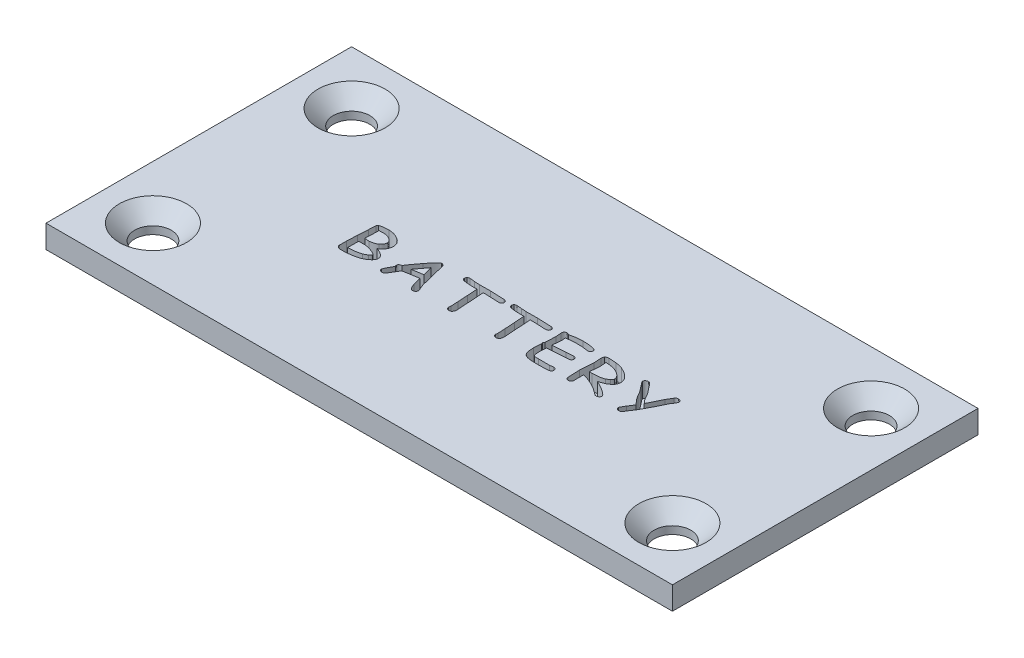
from build123d import *

# Parameters (mm, degrees)
SKETCH1_W                                       = 41
SKETCH1_H                                       = 20
BOSS_EXTRUDE2_DEPTH                             = 1.5
CSK_FOR_M2_FLAT_HEAD_MACHINE_SCREW1_D           = 2.4
CSK_FOR_M2_FLAT_HEAD_MACHINE_SCREW1_DEPTH       = 3.15
CSK_FOR_M2_FLAT_HEAD_MACHINE_SCREW1_CSINK_D     = 4.4
CSK_FOR_M2_FLAT_HEAD_MACHINE_SCREW1_CSINK_ANGLE = 90
CSK_FOR_M2_FLAT_HEAD_MACHINE_SCREW1_TIP         = 0.721032743
BATTERYTEXT_DEPTH                               = 1


with BuildPart() as part:
    # Sketch1 → Boss-Extrude2 (new body)
    with BuildSketch(Plane(origin=(0, 0, 0), x_dir=(1, 0, 0), z_dir=(0, 1, 0))):
        with Locations((20.5, 10)):
            Rectangle(SKETCH1_W, SKETCH1_H)
    extrude(amount=BOSS_EXTRUDE2_DEPTH)

    # CSK for M2 Flat Head Machine Screw1
    with Locations(Plane(origin=(3.5, 1.5, -3.5), x_dir=(0, 0, 1), z_dir=(0, 1, 0))):
        with Locations((0, 0), (-13, 0), (-13, 34), (0, 34)):
            CounterSinkHole(CSK_FOR_M2_FLAT_HEAD_MACHINE_SCREW1_D / 2, CSK_FOR_M2_FLAT_HEAD_MACHINE_SCREW1_CSINK_D / 2, depth=CSK_FOR_M2_FLAT_HEAD_MACHINE_SCREW1_DEPTH, counter_sink_angle=CSK_FOR_M2_FLAT_HEAD_MACHINE_SCREW1_CSINK_ANGLE)
            with Locations((0, 0, -(CSK_FOR_M2_FLAT_HEAD_MACHINE_SCREW1_DEPTH + CSK_FOR_M2_FLAT_HEAD_MACHINE_SCREW1_TIP / 2))):  # 118° drill point
                Cone(0, CSK_FOR_M2_FLAT_HEAD_MACHINE_SCREW1_D / 2, CSK_FOR_M2_FLAT_HEAD_MACHINE_SCREW1_TIP, mode=Mode.SUBTRACT)

    # Sketch3 → BatteryText (cut)
    # profile 1 of 7: a face of its own
    with BuildSketch(Plane(origin=(0, 1.5, 0), x_dir=(1, 0, 0), z_dir=(0, 1, 0))):
        with BuildLine():
            add(Edge.make_bspline(
                [(12.236857852, 8.289141911), (12.198233605, 8.27734423), (12.118939081, 8.253123914), (11.994669879, 8.223709407), (11.862645257, 8.198973989), (11.722869263, 8.178613802), (11.57532844, 8.162442805), (11.419932266, 8.151564865), (11.256779013, 8.144560392), (11.145394013, 8.143624518), (11.088420352, 8.143145817)],
                knots=[0, 0, 0, 0, 0.833848747, 1.711868697, 2.635440729, 3.607054444, 4.628179194, 5.699833025, 6.823459784, 8, 8, 8, 8], degree=3))
            add(Edge.make_bspline(
                [(11.088420352, 8.143145817), (11.074174465, 8.144059959), (11.045653854, 8.145890093), (11.003489151, 8.158853963), (10.962796312, 8.180212434), (10.924802656, 8.209012264), (10.892099161, 8.241854118), (10.867066487, 8.276475747), (10.851794804, 8.312529881), (10.849696228, 8.337190978), (10.848674259, 8.349200504)],
                knots=[0, 0, 0, 0, 0.994446544, 1.990905943, 3.053718667, 4.190693169, 5.308229797, 6.279727772, 7.162257312, 8, 8, 8, 8], degree=3))
            Line((10.848674259, 8.349200504), (10.848674259, 8.832110661))
            add(Edge.make_bspline(
                [(10.848674259, 8.832110661), (10.84878975, 8.852944291), (10.849032487, 8.896731961), (10.850399556, 8.965597151), (10.853745983, 9.040768396), (10.85673481, 9.122347855), (10.862088897, 9.210037058), (10.86709199, 9.304154398), (10.874163593, 9.404555851), (10.879253916, 9.47371386), (10.881877384, 9.509356754)],
                knots=[0, 0, 0, 0, 0.737269749, 1.549577474, 2.437251034, 3.399972927, 4.43832557, 5.546009878, 6.735254087, 8, 8, 8, 8], degree=3))
            add(Edge.make_bspline(
                [(10.881877384, 9.509356754), (10.88489714, 9.547598981), (10.890703842, 9.621135127), (10.89764881, 9.72746776), (10.904978995, 9.825559071), (10.909860589, 9.915616998), (10.915221001, 9.997441424), (10.918428733, 10.071032368), (10.921022875, 10.136459829), (10.921965447, 10.177323977), (10.922404727, 10.196368473)],
                knots=[0, 0, 0, 0, 1.337606126, 2.572088687, 3.715591131, 4.767379125, 5.716854745, 6.574747951, 7.335769662, 8, 8, 8, 8], degree=3))
            add(Edge.make_bspline(
                [(10.922404727, 10.196368473), (10.922383506, 10.209877479), (10.922338504, 10.238523956), (10.922719677, 10.283781361), (10.924426889, 10.333741722), (10.926198874, 10.388281018), (10.929208537, 10.447528416), (10.933231112, 10.511314818), (10.937608894, 10.579838259), (10.940782576, 10.627033459), (10.942424259, 10.651446598)],
                knots=[0, 0, 0, 0, 0.711579357, 1.508937258, 2.383786424, 3.344602073, 4.383239325, 5.508426734, 6.711158631, 8, 8, 8, 8], degree=3))
            add(Edge.make_bspline(
                [(10.942424259, 10.651446598), (10.944930466, 10.664339421), (10.949615012, 10.688438394), (10.964919121, 10.719569999), (10.983242287, 10.745514094), (11.000412488, 10.755785731), (11.008830509, 10.760821598)],
                knots=[0, 0, 0, 0, 1.181869745, 2.20912422, 3.121988737, 4, 4, 4, 4], degree=3))
            add(Edge.make_bspline(
                [(11.008830509, 10.760821598), (11.056052044, 10.771826437), (11.152932072, 10.794404041), (11.304923734, 10.814576223), (11.465765562, 10.828386959), (11.576180456, 10.829879651), (11.632853946, 10.830645817)],
                knots=[0, 0, 0, 0, 0.923894863, 1.895469064, 2.919791436, 4, 4, 4, 4], degree=3))
            add(Edge.make_bspline(
                [(11.632853946, 10.830645817), (11.66233795, 10.830121025), (11.721127869, 10.82907461), (11.808766107, 10.819434339), (11.895575399, 10.80381077), (11.981348453, 10.781754149), (12.066386016, 10.753810486), (12.150465546, 10.719364787), (12.234084115, 10.67921982), (12.287857012, 10.647452269), (12.314982852, 10.631427067)],
                knots=[0, 0, 0, 0, 0.982863019, 1.959789414, 2.93597685, 3.921891874, 4.910447328, 5.918271459, 6.949868091, 8, 8, 8, 8], degree=3))
            add(Edge.make_bspline(
                [(12.314982852, 10.631427067), (12.34481527, 10.612271758), (12.402317299, 10.575349872), (12.479755086, 10.513038958), (12.544992775, 10.446923381), (12.599397461, 10.377786086), (12.640505827, 10.304229456), (12.670985076, 10.227904077), (12.689119505, 10.147733882), (12.691315094, 10.093105964), (12.692424259, 10.065509098)],
                knots=[0, 0, 0, 0, 1.192675996, 2.29888479, 3.337025053, 4.313313312, 5.250312127, 6.162794191, 7.071882586, 8, 8, 8, 8], degree=3))
            add(Edge.make_bspline(
                [(12.692424259, 10.065509098), (12.691263789, 10.030749362), (12.688989876, 9.962638501), (12.669363785, 9.863534281), (12.637475219, 9.770148697), (12.59244594, 9.682448229), (12.534972835, 9.600281379), (12.463942133, 9.524739609), (12.380984897, 9.454235811), (12.318421169, 9.413923692), (12.286174259, 9.393145817)],
                knots=[0, 0, 0, 0, 1.010852803, 1.980741593, 2.927496559, 3.874476657, 4.840377935, 5.835875176, 6.884555922, 8, 8, 8, 8], degree=3))
            add(Edge.make_bspline(
                [(12.286174259, 9.393145817), (12.310337117, 9.384386473), (12.357349655, 9.367343829), (12.424638012, 9.339319146), (12.487483904, 9.311123527), (12.54551036, 9.281715154), (12.599162435, 9.252282265), (12.647910962, 9.221801558), (12.691992169, 9.190571379), (12.731547767, 9.158511875), (12.766370044, 9.12560801), (12.796997402, 9.092486806), (12.82263259, 9.058171282), (12.843163632, 9.022824109), (12.859437319, 8.987016196), (12.8714503, 8.95057868), (12.878404849, 8.913104778), (12.879415878, 8.887802357), (12.879924259, 8.875079411)],
                knots=[0, 0, 0, 0, 1.475553667, 2.870915498, 4.18421609, 5.429694743, 6.605186387, 7.696851297, 8.72892637, 9.705385872, 10.617709728, 11.477698945, 12.292635192, 13.071626274, 13.820316972, 14.547346485, 15.269554793, 16, 16, 16, 16], degree=3))
            add(Edge.make_bspline(
                [(12.879924259, 8.875079411), (12.879183244, 8.858407519), (12.877681617, 8.824622828), (12.864866474, 8.77448397), (12.843866524, 8.724958353), (12.814650161, 8.676110082), (12.777691282, 8.627434761), (12.732120247, 8.579639566), (12.679037808, 8.531557656), (12.639000478, 8.502163061), (12.618205509, 8.486895817)],
                knots=[0, 0, 0, 0, 0.822203525, 1.666151249, 2.537766831, 3.470824597, 4.468924793, 5.549120678, 6.727038945, 8, 8, 8, 8], degree=3))
            add(Edge.make_bspline(
                [(12.618205509, 8.486895817), (12.587932109, 8.465715553), (12.528016495, 8.423796624), (12.433221972, 8.370363132), (12.336703765, 8.32418442), (12.269971831, 8.300763788), (12.236857852, 8.289141911)],
                knots=[0, 0, 0, 0, 1.027462577, 2.033503045, 3.024177254, 4, 4, 4, 4], degree=3))
        make_face()
        with BuildLine():
            add(Edge.make_bspline(
                [(11.626018009, 10.486895817), (11.608439731, 10.486934264), (11.574584455, 10.487008313), (11.52575401, 10.486497994), (11.480987831, 10.485624045), (11.440307866, 10.483978205), (11.403832634, 10.482711076), (11.37143085, 10.48078846), (11.343122849, 10.478290461), (11.325560524, 10.476496468), (11.317424259, 10.475665348)],
                knots=[0, 0, 0, 0, 1.365518889, 2.629951448, 3.793446074, 4.843557905, 5.79259323, 6.62860816, 7.364662269, 8, 8, 8, 8], degree=3))
            Line((11.317424259, 10.475665348), (11.314494571, 10.196856754))
            Line((11.314494571, 10.196856754), (11.286174259, 9.580645817))
            add(Edge.make_bspline(
                [(11.286174259, 9.580645817), (11.308303318, 9.577985215), (11.349937739, 9.572979462), (11.408406187, 9.566801375), (11.458694246, 9.56137656), (11.500687619, 9.557017191), (11.534373993, 9.553479363), (11.559771552, 9.55126502), (11.576998433, 9.549208462), (11.585814158, 9.549347139), (11.588908634, 9.549395817)],
                knots=[0, 0, 0, 0, 1.757254332, 3.306162598, 4.635424894, 5.745045507, 6.635031894, 7.305398842, 7.756182751, 8, 8, 8, 8], degree=3))
            add(Edge.make_bspline(
                [(11.588908634, 9.549395817), (11.613509165, 9.551446012), (11.661533182, 9.555448308), (11.731841904, 9.56518654), (11.798642074, 9.578570337), (11.861854425, 9.596636465), (11.922075743, 9.616541967), (11.978441913, 9.641490766), (12.031853613, 9.668779471), (12.064837606, 9.690529985), (12.081096134, 9.701251286)],
                knots=[0, 0, 0, 0, 1.136206223, 2.218049089, 3.265728167, 4.269179872, 5.242991513, 6.182535025, 7.104131989, 8, 8, 8, 8], degree=3))
            add(Edge.make_bspline(
                [(12.081096134, 9.701251286), (12.097314044, 9.713292291), (12.129071348, 9.736870536), (12.171090511, 9.776954209), (12.206627962, 9.819750738), (12.235739849, 9.864973658), (12.25850172, 9.91285491), (12.274723442, 9.963397196), (12.284028411, 10.016665678), (12.285451404, 10.05294117), (12.286174259, 10.071368473)],
                knots=[0, 0, 0, 0, 1.098152201, 2.150360486, 3.150338723, 4.118120512, 5.06873589, 6.026459463, 6.997476637, 8, 8, 8, 8], degree=3))
            add(Edge.make_bspline(
                [(12.286174259, 10.071368473), (12.285463687, 10.08412017), (12.284031277, 10.109825724), (12.273898363, 10.14789378), (12.256881949, 10.184769709), (12.233541854, 10.221083379), (12.202750712, 10.255788273), (12.166542258, 10.290872651), (12.123027702, 10.32441868), (12.074116267, 10.35681784), (12.021752007, 10.38728511), (11.967318508, 10.413683498), (11.912278229, 10.435964588), (11.856680417, 10.455036072), (11.800076211, 10.468915396), (11.74268233, 10.479221257), (11.684606699, 10.485895385), (11.645567038, 10.486562007), (11.626018009, 10.486895817)],
                knots=[0, 0, 0, 0, 0.725212267, 1.46192166, 2.224484312, 3.028485566, 3.908367568, 4.858041673, 5.893590324, 7.028808282, 8.194659934, 9.337744584, 10.467548508, 11.571554771, 12.678818612, 13.77959661, 14.888137594, 16, 16, 16, 16], degree=3))
        make_face(mode=Mode.SUBTRACT)
        with BuildLine():
            Line((11.856486759, 9.181720036), (11.648967227, 9.210528629))
            add(Edge.make_bspline(
                [(11.648967227, 9.210528629), (11.638223236, 9.210427849), (11.612327726, 9.210184946), (11.57133053, 9.208087734), (11.529845557, 9.205962773), (11.503461371, 9.205740461), (11.492228946, 9.205645817)],
                knots=[0, 0, 0, 0, 0.822045968, 1.981321332, 3.140596696, 4, 4, 4, 4], degree=3))
            add(Edge.make_bspline(
                [(11.492228946, 9.205645817), (11.455770613, 9.205645817), (11.3805753, 9.205645817), (11.305379988, 9.205645817), (11.266643009, 9.205645817)],
                knots=[0, 0, 0, 0, 0.96969697, 2, 2, 2, 2], degree=3))
            add(Edge.make_bspline(
                [(11.266643009, 9.205645817), (11.264990101, 9.171630471), (11.261779688, 9.105563055), (11.257517067, 9.009225124), (11.255794749, 8.918379441), (11.255208451, 8.859617412), (11.254924259, 8.831134098)],
                knots=[0, 0, 0, 0, 1.090559587, 2.118174955, 3.087835911, 4, 4, 4, 4], degree=3))
            Line((11.254924259, 8.831134098), (11.254924259, 8.486895817))
            add(Edge.make_bspline(
                [(11.254924259, 8.486895817), (11.296765785, 8.488447083), (11.378392214, 8.491473368), (11.497899699, 8.499915132), (11.611418042, 8.510937572), (11.71905542, 8.52513782), (11.820796566, 8.541887024), (11.91628516, 8.562671898), (12.00631457, 8.585076242), (12.063451683, 8.603753049), (12.09135004, 8.612872379)],
                knots=[0, 0, 0, 0, 1.183743666, 2.309303157, 3.386732239, 4.40788457, 5.378513927, 6.300941056, 7.170399928, 8, 8, 8, 8], degree=3))
            add(Edge.make_bspline(
                [(12.09135004, 8.612872379), (12.114169704, 8.621035372), (12.160245676, 8.637517552), (12.226420043, 8.671073181), (12.292068513, 8.70929989), (12.333162242, 8.739900044), (12.354045352, 8.755450504)],
                knots=[0, 0, 0, 0, 0.967706838, 1.95393036, 2.960223361, 4, 4, 4, 4], degree=3))
            add(Edge.make_bspline(
                [(12.354045352, 8.755450504), (12.363358119, 8.762565021), (12.381033544, 8.776068216), (12.405492747, 8.795885088), (12.426032213, 8.81461835), (12.44347149, 8.831464953), (12.456492679, 8.847527468), (12.466346562, 8.861807342), (12.47213283, 8.87515438), (12.473192299, 8.883828712), (12.473674259, 8.887774723)],
                knots=[0, 0, 0, 0, 1.541912951, 2.92651688, 4.139354489, 5.199263338, 6.112287804, 6.85468737, 7.478989676, 8, 8, 8, 8], degree=3))
            add(Edge.make_bspline(
                [(12.473674259, 8.887774723), (12.472823205, 8.894753255), (12.47099193, 8.909769487), (12.457662597, 8.931230616), (12.437623786, 8.952734427), (12.409531677, 8.974684714), (12.373904894, 8.997224737), (12.330553369, 9.020803977), (12.279258585, 9.044309352), (12.24227801, 9.059766383), (12.222697696, 9.067950504)],
                knots=[0, 0, 0, 0, 0.520908641, 1.120878368, 1.845363695, 2.720630374, 3.778425429, 4.999699901, 6.411414114, 8, 8, 8, 8], degree=3))
            add(Edge.make_bspline(
                [(12.222697696, 9.067950504), (12.191700299, 9.080074037), (12.130453316, 9.104028622), (12.038331311, 9.135258752), (11.947258423, 9.161459182), (11.886508516, 9.175018975), (11.856486759, 9.181720036)],
                knots=[0, 0, 0, 0, 1.040084329, 2.055076603, 3.038845978, 4, 4, 4, 4], degree=3))
        make_face(mode=Mode.SUBTRACT)
    # profile 2 of 7: a face of its own
    with BuildSketch(Plane(origin=(0, 1.5, 0), x_dir=(1, 0, 0), z_dir=(0, 1, 0))):
        with BuildLine():
            add(Edge.make_bspline(
                [(15.817717227, 8.174395817), (15.802691138, 8.175626568), (15.77208031, 8.17813383), (15.728182484, 8.199390928), (15.686082925, 8.231816742), (15.646956197, 8.278197847), (15.608151318, 8.335869491), (15.571622141, 8.406515079), (15.536452846, 8.489733386), (15.515734125, 8.550064524), (15.504728946, 8.582110661)],
                knots=[0, 0, 0, 0, 0.660925651, 1.346423655, 2.115779037, 2.99709471, 4.012122428, 5.182822105, 6.503597499, 8, 8, 8, 8], degree=3))
            add(Edge.make_bspline(
                [(15.504728946, 8.582110661), (15.500111077, 8.595925538), (15.490155378, 8.625709135), (15.475511082, 8.674023652), (15.460652822, 8.729536661), (15.443784467, 8.791885661), (15.426859774, 8.861603176), (15.40958421, 8.938408643), (15.390135362, 9.021905524), (15.377830605, 9.080133602), (15.371428165, 9.110430973)],
                knots=[0, 0, 0, 0, 0.641244705, 1.382464189, 2.222059324, 3.171022673, 4.225905395, 5.38005334, 6.636783184, 8, 8, 8, 8], degree=3))
            add(Edge.make_bspline(
                [(15.371428165, 9.110430973), (15.354329355, 9.108383515), (15.318786249, 9.104127486), (15.263813105, 9.096146849), (15.20506331, 9.087315389), (15.142510867, 9.077694108), (15.076167372, 9.066237439), (15.005791226, 9.054222293), (14.931785721, 9.040421254), (14.881191541, 9.030852372), (14.855314884, 9.025958317)],
                knots=[0, 0, 0, 0, 0.790101177, 1.642374555, 2.548530537, 3.516001174, 4.546037141, 5.637479607, 6.791676637, 8, 8, 8, 8], degree=3))
            Line((14.855314884, 9.025958317), (14.340666446, 8.933184879))
            add(Edge.make_bspline(
                [(14.340666446, 8.933184879), (14.330874392, 8.913906114), (14.310127604, 8.87305948), (14.274287767, 8.809795122), (14.235308745, 8.739294038), (14.189868326, 8.66344085), (14.1408128, 8.580567792), (14.085979185, 8.492144652), (14.026819586, 8.396936059), (13.985265127, 8.331742805), (13.963713321, 8.297930973)],
                knots=[0, 0, 0, 0, 0.702205874, 1.487789632, 2.361185406, 3.318579069, 4.359353742, 5.489044622, 6.697717996, 8, 8, 8, 8], degree=3))
            add(Edge.make_bspline(
                [(13.963713321, 8.297930973), (13.952657837, 8.283761311), (13.931274056, 8.256354014), (13.888585728, 8.226747764), (13.840085332, 8.208781766), (13.805669251, 8.206712345), (13.787932071, 8.205645817)],
                knots=[0, 0, 0, 0, 1.038112708, 2.007942224, 2.973343693, 4, 4, 4, 4], degree=3))
            add(Edge.make_bspline(
                [(13.787932071, 8.205645817), (13.774845969, 8.206133976), (13.748981354, 8.207098821), (13.711534719, 8.217077845), (13.675735486, 8.231655356), (13.643073199, 8.252337656), (13.615313563, 8.27756298), (13.595003756, 8.306928994), (13.581975262, 8.339210724), (13.580610569, 8.362102299), (13.579924259, 8.373614567)],
                knots=[0, 0, 0, 0, 1.060112501, 2.095307105, 3.126021972, 4.189177353, 5.21768748, 6.148709225, 7.068978255, 8, 8, 8, 8], degree=3))
            add(Edge.make_bspline(
                [(13.579924259, 8.373614567), (13.580108326, 8.37754379), (13.580537087, 8.386696429), (13.585208636, 8.401711043), (13.590924615, 8.420503346), (13.59923119, 8.442688045), (13.61022404, 8.468309272), (13.623441174, 8.497358548), (13.638379291, 8.530329394), (13.656765894, 8.566152158), (13.676651038, 8.606100797), (13.699606611, 8.649064633), (13.72464995, 8.695787798), (13.751905536, 8.745967981), (13.781681215, 8.799686889), (13.814034592, 8.856652829), (13.84803182, 8.917490191), (13.872170473, 8.958779161), (13.884611759, 8.980059879)],
                knots=[0, 0, 0, 0, 0.276369849, 0.643769381, 1.101070131, 1.663844365, 2.311785902, 3.066826767, 3.914005249, 4.863436213, 5.905256884, 7.060255298, 8.297603194, 9.642995802, 11.086418833, 12.627959933, 14.262019208, 16, 16, 16, 16], degree=3))
            add(Edge.make_bspline(
                [(13.884611759, 8.980059879), (13.879220571, 8.987351679), (13.868648156, 9.001651301), (13.858744806, 9.026543486), (13.851207471, 9.052365898), (13.850692587, 9.070495982), (13.850432071, 9.079669254)],
                knots=[0, 0, 0, 0, 1.009744039, 1.9801637, 2.9780241, 4, 4, 4, 4], degree=3))
            add(Edge.make_bspline(
                [(13.850432071, 9.079669254), (13.850927682, 9.090477846), (13.851893957, 9.111550998), (13.861435794, 9.141601413), (13.877818191, 9.168057509), (13.899549115, 9.191999448), (13.928270195, 9.211985261), (13.962666648, 9.22900403), (14.003356262, 9.242509835), (14.032655055, 9.249052587), (14.048185977, 9.252520817)],
                knots=[0, 0, 0, 0, 0.899971203, 1.754643976, 2.595393939, 3.479654745, 4.433155206, 5.495952632, 6.672635905, 8, 8, 8, 8], degree=3))
            add(Edge.make_bspline(
                [(14.048185977, 9.252520817), (14.067959812, 9.282199462), (14.108435709, 9.342949937), (14.17209114, 9.435007664), (14.23875938, 9.530826966), (14.309793297, 9.629466012), (14.384475413, 9.731540327), (14.463018934, 9.836782241), (14.545131972, 9.9454098), (14.601510333, 10.018518022), (14.630217227, 10.055743473)],
                knots=[0, 0, 0, 0, 0.862657079, 1.765809254, 2.707313854, 3.686302139, 4.706091037, 5.766762513, 6.862873797, 8, 8, 8, 8], degree=3))
            add(Edge.make_bspline(
                [(14.630217227, 10.055743473), (14.649365111, 10.080690919), (14.686652656, 10.129272213), (14.741829021, 10.199167721), (14.793310653, 10.264919432), (14.842912915, 10.325086181), (14.889668602, 10.38041429), (14.933022558, 10.431576871), (14.974108593, 10.477280049), (15.012024747, 10.518636466), (15.047909216, 10.554388335), (15.079710989, 10.586611067), (15.109841572, 10.613000625), (15.136683647, 10.634941328), (15.161011603, 10.651954929), (15.182384983, 10.664389004), (15.201291369, 10.672432296), (15.213336539, 10.673799026), (15.218596134, 10.674395817)],
                knots=[0, 0, 0, 0, 1.749371826, 3.406631238, 4.95355036, 6.394514847, 7.743880077, 8.983206506, 10.124572584, 11.162419658, 12.103546302, 12.942242421, 13.679843582, 14.33027665, 14.870256576, 15.328441159, 15.706759854, 16, 16, 16, 16], degree=3))
            add(Edge.make_bspline(
                [(15.218596134, 10.674395817), (15.231333623, 10.673826579), (15.255958097, 10.672726113), (15.291330341, 10.664425618), (15.32318014, 10.649710182), (15.352463043, 10.630180634), (15.377988609, 10.604226065), (15.400148825, 10.572805282), (15.419199678, 10.535935404), (15.428880204, 10.508838263), (15.433928165, 10.494708317)],
                knots=[0, 0, 0, 0, 1.008789824, 1.950221022, 2.856280161, 3.775458072, 4.723752771, 5.722103986, 6.812179257, 8, 8, 8, 8], degree=3))
            Line((15.433928165, 10.494708317), (15.557463321, 9.941973942))
            Line((15.557463321, 9.941973942), (15.848967227, 8.797930973))
            Line((15.848967227, 8.797930973), (15.960783634, 8.529376286))
            add(Edge.make_bspline(
                [(15.960783634, 8.529376286), (15.969350697, 8.508471282), (15.984831565, 8.470695491), (16.002063847, 8.418930384), (16.014464245, 8.378883868), (16.016561019, 8.355435997), (16.017424259, 8.345782536)],
                knots=[0, 0, 0, 0, 1.404800727, 2.538505072, 3.398304213, 4, 4, 4, 4], degree=3))
            add(Edge.make_bspline(
                [(16.017424259, 8.345782536), (16.016647243, 8.334142052), (16.015110139, 8.31111467), (16.003555106, 8.278053153), (15.983531644, 8.248629175), (15.957451898, 8.222678981), (15.926346174, 8.201481019), (15.892294421, 8.185528137), (15.855673093, 8.175926255), (15.83046862, 8.174909972), (15.817717227, 8.174395817)],
                knots=[0, 0, 0, 0, 0.95778085, 1.894696644, 2.842766023, 3.866476231, 4.907591803, 5.927168634, 6.951317581, 8, 8, 8, 8], degree=3))
        make_face()
        with BuildLine():
            Line((15.126799259, 10.078692692), (14.561369571, 9.327716129))
            add(Edge.make_bspline(
                [(14.561369571, 9.327716129), (14.582522743, 9.331976302), (14.627395746, 9.341013562), (14.698649463, 9.354731509), (14.777770118, 9.368815349), (14.864531363, 9.383426409), (14.958981704, 9.398426534), (15.060979992, 9.414718948), (15.170898529, 9.431129168), (15.246753865, 9.44246157), (15.285978946, 9.448321598)],
                knots=[0, 0, 0, 0, 0.704896645, 1.495323266, 2.370367166, 3.330138159, 4.369469301, 5.494486, 6.704389237, 8, 8, 8, 8], degree=3))
            Line((15.285978946, 9.448321598), (15.126799259, 10.078692692))
        make_face(mode=Mode.SUBTRACT)
    # profile 3 of 7: a face of its own
    with BuildSketch(Plane(origin=(0, 1.5, 0), x_dir=(1, 0, 0), z_dir=(0, 1, 0))):
        with BuildLine():
            add(Edge.make_bspline(
                [(19.297502384, 10.325763004), (19.284481167, 10.32590057), (19.256645898, 10.326194643), (19.212373729, 10.327211911), (19.163058215, 10.32872068), (19.108844112, 10.330531167), (19.049776749, 10.333664124), (18.985647854, 10.337051547), (18.916473913, 10.340954266), (18.868627829, 10.343815077), (18.843889102, 10.345294254)],
                knots=[0, 0, 0, 0, 0.6882467, 1.471255207, 2.340481981, 3.295969473, 4.338140202, 5.466663837, 6.690143336, 8, 8, 8, 8], degree=3))
            add(Edge.make_bspline(
                [(18.843889102, 10.345294254), (18.819804271, 10.346825633), (18.772950091, 10.349804749), (18.704895717, 10.35303172), (18.641421858, 10.356028963), (18.582501244, 10.358438096), (18.527984603, 10.36059321), (18.477843251, 10.361411037), (18.432269432, 10.361998755), (18.403459591, 10.361928946), (18.38978754, 10.361895817)],
                knots=[0, 0, 0, 0, 1.274391646, 2.479177632, 3.597701107, 4.629981294, 5.593221275, 6.478660511, 7.278030307, 8, 8, 8, 8], degree=3))
            Line((18.38978754, 10.361895817), (18.248674259, 10.361895817))
            add(Edge.make_bspline(
                [(18.248674259, 10.361895817), (18.249252274, 10.341547965), (18.250491993, 10.297906223), (18.254099447, 10.227918996), (18.258930675, 10.149135245), (18.265494833, 10.06143168), (18.272797596, 9.96507661), (18.280870096, 9.859722223), (18.291462899, 9.74568282), (18.298655469, 9.666584395), (18.302385196, 9.625567692)],
                knots=[0, 0, 0, 0, 0.661608629, 1.419007489, 2.277644811, 3.227077685, 4.277531068, 5.418465658, 6.661338333, 8, 8, 8, 8], degree=3))
            add(Edge.make_bspline(
                [(18.302385196, 9.625567692), (18.305863491, 9.587161613), (18.312626193, 9.512490304), (18.321482867, 9.403602985), (18.328542208, 9.301357774), (18.335356437, 9.205862011), (18.33947745, 9.116953515), (18.342857906, 9.034597409), (18.345756335, 8.958921072), (18.345814519, 8.91072638), (18.345842227, 8.887774723)],
                knots=[0, 0, 0, 0, 1.251891216, 2.433998922, 3.546412713, 4.579030411, 5.541847377, 6.435566233, 7.254972974, 8, 8, 8, 8], degree=3))
            add(Edge.make_bspline(
                [(18.345842227, 8.887774723), (18.346101881, 8.876867299), (18.346675903, 8.85275407), (18.349227887, 8.812848906), (18.353843148, 8.765673939), (18.359336903, 8.713420271), (18.365857629, 8.661281816), (18.370300561, 8.61374105), (18.372834545, 8.57334823), (18.373413662, 8.548747255), (18.373674259, 8.537677067)],
                knots=[0, 0, 0, 0, 0.745200277, 1.647426949, 2.730450509, 3.982730333, 5.236243274, 6.319266834, 7.24368716, 8, 8, 8, 8], degree=3))
            add(Edge.make_bspline(
                [(18.373674259, 8.537677067), (18.373098734, 8.519739529), (18.371977828, 8.484803968), (18.363686915, 8.434413387), (18.349739649, 8.387551254), (18.335368575, 8.359273581), (18.328264102, 8.345294254)],
                knots=[0, 0, 0, 0, 1.077115515, 2.097815008, 3.059637366, 4, 4, 4, 4], degree=3))
            add(Edge.make_bspline(
                [(18.328264102, 8.345294254), (18.323472515, 8.33666107), (18.31411975, 8.319809841), (18.296216465, 8.298026022), (18.27711846, 8.278801786), (18.255222615, 8.263822585), (18.231833595, 8.251181134), (18.205920538, 8.243253725), (18.178463413, 8.237385492), (18.159353308, 8.237061809), (18.149553165, 8.236895817)],
                knots=[0, 0, 0, 0, 1.070504368, 2.089531839, 3.052393298, 4.00414947, 4.961147712, 5.928544882, 6.937705592, 8, 8, 8, 8], degree=3))
            add(Edge.make_bspline(
                [(18.149553165, 8.236895817), (18.136155138, 8.237434779), (18.109712571, 8.238498485), (18.071366117, 8.247665978), (18.034980049, 8.262080965), (18.001446509, 8.281590738), (17.97231239, 8.3057471), (17.951991164, 8.33515336), (17.937955874, 8.367208145), (17.936774769, 8.390229903), (17.936174259, 8.401934879)],
                knots=[0, 0, 0, 0, 1.075664096, 2.122948356, 3.150599965, 4.211927105, 5.232223924, 6.161476792, 7.06523768, 8, 8, 8, 8], degree=3))
            add(Edge.make_bspline(
                [(17.936174259, 8.401934879), (17.936797109, 8.412212655), (17.938299754, 8.437008103), (17.945999826, 8.475818068), (17.953543159, 8.514654968), (17.955074742, 8.539607616), (17.955705509, 8.549884098)],
                knots=[0, 0, 0, 0, 0.826333245, 1.993554289, 3.173666755, 4, 4, 4, 4], degree=3))
            add(Edge.make_bspline(
                [(17.955705509, 8.549884098), (17.95540217, 8.565020843), (17.954726855, 8.598719434), (17.953065014, 8.654433762), (17.948057887, 8.720134207), (17.94306999, 8.792563658), (17.937739542, 8.864961216), (17.933576618, 8.930867755), (17.931754878, 8.986887036), (17.931098373, 9.020912217), (17.930803165, 9.036212223)],
                knots=[0, 0, 0, 0, 0.746038136, 1.660887738, 2.745999336, 3.992235283, 5.238471231, 6.323078864, 7.245943637, 8, 8, 8, 8], degree=3))
            add(Edge.make_bspline(
                [(17.930803165, 9.036212223), (17.930729721, 9.056884062), (17.930575863, 9.100189648), (17.928490554, 9.168073061), (17.924927946, 9.241957523), (17.920484353, 9.321871107), (17.915405828, 9.407857008), (17.907685284, 9.499605141), (17.899473936, 9.59743129), (17.893405894, 9.664633366), (17.890275821, 9.699298161)],
                knots=[0, 0, 0, 0, 0.746545009, 1.563942615, 2.452492704, 3.417955713, 4.454524338, 5.563123741, 6.74298803, 8, 8, 8, 8], degree=3))
            add(Edge.make_bspline(
                [(17.890275821, 9.699298161), (17.886791123, 9.736401634), (17.88008348, 9.807821557), (17.871469103, 9.911041881), (17.8634415, 10.006065101), (17.857225677, 10.093003831), (17.851830054, 10.171778188), (17.847253167, 10.242399634), (17.844372898, 10.304916573), (17.843042154, 10.343828221), (17.842424259, 10.361895817)],
                knots=[0, 0, 0, 0, 1.346132914, 2.591151223, 3.741449212, 4.790735251, 5.739494213, 6.593619718, 7.346984476, 8, 8, 8, 8], degree=3))
            Line((17.842424259, 10.361895817), (17.660783634, 10.360430973))
            add(Edge.make_bspline(
                [(17.660783634, 10.360430973), (17.625300167, 10.360639862), (17.556277987, 10.361046193), (17.455681341, 10.363568657), (17.360916332, 10.367218488), (17.272039721, 10.373177079), (17.18900559, 10.3804361), (17.11178093, 10.389027231), (17.040443968, 10.39966422), (16.995066569, 10.40845645), (16.973283634, 10.412677067)],
                knots=[0, 0, 0, 0, 1.2331945, 2.398800886, 3.497117326, 4.528857059, 5.494218118, 6.393744801, 7.22893436, 8, 8, 8, 8], degree=3))
            add(Edge.make_bspline(
                [(16.973283634, 10.412677067), (16.960483731, 10.415759161), (16.936237442, 10.421597436), (16.903239832, 10.435090007), (16.87469021, 10.450510116), (16.851386385, 10.469677578), (16.833318483, 10.49217712), (16.820597326, 10.517482608), (16.812237929, 10.545620459), (16.811538335, 10.565445729), (16.811174259, 10.575763004)],
                knots=[0, 0, 0, 0, 1.252928948, 2.373367963, 3.387285493, 4.334592177, 5.228454482, 6.116375643, 7.019742405, 8, 8, 8, 8], degree=3))
            add(Edge.make_bspline(
                [(16.811174259, 10.575763004), (16.811846579, 10.586745385), (16.813178583, 10.608503707), (16.823425323, 10.639773367), (16.839832453, 10.668905973), (16.855076957, 10.685418547), (16.862932071, 10.693927067)],
                knots=[0, 0, 0, 0, 0.993834084, 1.968986864, 2.953469337, 4, 4, 4, 4], degree=3))
            add(Edge.make_bspline(
                [(16.862932071, 10.693927067), (16.873323513, 10.702749653), (16.893913416, 10.72023098), (16.931370853, 10.737406446), (16.972782736, 10.747028412), (17.001712408, 10.746786901), (17.016740665, 10.746661442)],
                knots=[0, 0, 0, 0, 0.974217531, 1.930342694, 2.924863658, 4, 4, 4, 4], degree=3))
            add(Edge.make_bspline(
                [(17.016740665, 10.746661442), (17.023578757, 10.746373639), (17.039060617, 10.745722037), (17.064940756, 10.743658772), (17.096324735, 10.740580158), (17.133436117, 10.737180332), (17.176273873, 10.733443996), (17.224576128, 10.728335346), (17.278483993, 10.723137481), (17.31622417, 10.719034548), (17.336076602, 10.716876286)],
                knots=[0, 0, 0, 0, 0.512067829, 1.159352896, 1.942181197, 2.871648949, 3.94775795, 5.159543841, 6.505837294, 8, 8, 8, 8], degree=3))
            add(Edge.make_bspline(
                [(17.336076602, 10.716876286), (17.367646084, 10.71404444), (17.427824312, 10.708646332), (17.51324825, 10.701995468), (17.589467546, 10.698577901), (17.637018262, 10.697738637), (17.65931879, 10.697345036)],
                knots=[0, 0, 0, 0, 1.174189912, 2.238258733, 3.173771413, 4, 4, 4, 4], degree=3))
            add(Edge.make_bspline(
                [(17.65931879, 10.697345036), (17.681779542, 10.697527998), (17.73190909, 10.697936348), (17.814923311, 10.69811262), (17.913384669, 10.700035517), (18.00388513, 10.700910306), (18.07989299, 10.702146868), (18.135062882, 10.703368511), (18.186343054, 10.703465984), (18.233695821, 10.704751766), (18.277155862, 10.705309201), (18.316710618, 10.70493841), (18.352350541, 10.705793416), (18.374813265, 10.705693076), (18.385393009, 10.705645817)],
                knots=[0, 0, 0, 0, 1.113590853, 2.485393389, 4.11556913, 5.995868857, 6.972385961, 7.884358209, 8.731671776, 9.514558982, 10.232770864, 10.886383117, 11.47549634, 12, 12, 12, 12], degree=3))
            add(Edge.make_bspline(
                [(18.385393009, 10.705645817), (18.399064514, 10.705463036), (18.427872132, 10.705077894), (18.473294621, 10.704891122), (18.523253696, 10.70310717), (18.577959599, 10.70142357), (18.63733477, 10.698076787), (18.701335876, 10.695557372), (18.769836478, 10.691369785), (18.841447968, 10.687097319), (18.913057863, 10.682788541), (18.981562839, 10.678700522), (19.045542146, 10.675851963), (19.104964874, 10.673605661), (19.159627049, 10.670878033), (19.209602643, 10.669336209), (19.254860133, 10.669097603), (19.28350523, 10.668716274), (19.297014102, 10.668536442)],
                knots=[0, 0, 0, 0, 0.719223377, 1.515496011, 2.389154438, 3.348662341, 4.394437082, 5.517179374, 6.717755406, 8.004301415, 9.290847423, 10.491423456, 11.614165747, 12.65955491, 13.619406524, 14.493064952, 15.289337585, 16, 16, 16, 16], degree=3))
            add(Edge.make_bspline(
                [(19.297014102, 10.668536442), (19.310733926, 10.668024865), (19.337532781, 10.667025606), (19.375920325, 10.657781127), (19.410426061, 10.641525959), (19.441116822, 10.620363691), (19.466383619, 10.594278847), (19.485245562, 10.564473176), (19.497004058, 10.53136711), (19.498113646, 10.507986216), (19.498674259, 10.496173161)],
                knots=[0, 0, 0, 0, 1.113235383, 2.174476575, 3.179912316, 4.195722561, 5.186716038, 6.107321415, 7.043735562, 8, 8, 8, 8], degree=3))
            add(Edge.make_bspline(
                [(19.498674259, 10.496173161), (19.498100835, 10.48452184), (19.496975867, 10.461663744), (19.485459368, 10.428948763), (19.467181074, 10.399107834), (19.441386661, 10.373516469), (19.411067549, 10.352146112), (19.376264954, 10.336661535), (19.338042019, 10.327230731), (19.311229303, 10.326259984), (19.297502384, 10.325763004)],
                knots=[0, 0, 0, 0, 0.948584989, 1.860977478, 2.798219722, 3.785433829, 4.807143037, 5.812895913, 6.880299892, 8, 8, 8, 8], degree=3))
        make_face()
    # profile 4 of 7: a face of its own
    with BuildSketch(Plane(origin=(0, 1.5, 0), x_dir=(1, 0, 0), z_dir=(0, 1, 0))):
        with BuildLine():
            add(Edge.make_bspline(
                [(22.372502384, 10.325763004), (22.359481167, 10.32590057), (22.331645898, 10.326194643), (22.287373729, 10.327211911), (22.238058215, 10.32872068), (22.183844112, 10.330531167), (22.124776749, 10.333664124), (22.060647854, 10.337051547), (21.991473913, 10.340954266), (21.943627829, 10.343815077), (21.918889102, 10.345294254)],
                knots=[0, 0, 0, 0, 0.6882467, 1.471255207, 2.340481981, 3.295969473, 4.338140202, 5.466663837, 6.690143336, 8, 8, 8, 8], degree=3))
            add(Edge.make_bspline(
                [(21.918889102, 10.345294254), (21.894804271, 10.346825633), (21.847950091, 10.349804749), (21.779895717, 10.35303172), (21.716421858, 10.356028963), (21.657501244, 10.358438096), (21.602984603, 10.36059321), (21.552843251, 10.361411037), (21.507269432, 10.361998755), (21.478459591, 10.361928946), (21.46478754, 10.361895817)],
                knots=[0, 0, 0, 0, 1.274391646, 2.479177632, 3.597701107, 4.629981294, 5.593221275, 6.478660511, 7.278030307, 8, 8, 8, 8], degree=3))
            Line((21.46478754, 10.361895817), (21.323674259, 10.361895817))
            add(Edge.make_bspline(
                [(21.323674259, 10.361895817), (21.324252274, 10.341547965), (21.325491993, 10.297906223), (21.329099447, 10.227918996), (21.333930675, 10.149135245), (21.340494833, 10.06143168), (21.347797596, 9.96507661), (21.355870096, 9.859722223), (21.366462899, 9.74568282), (21.373655469, 9.666584395), (21.377385196, 9.625567692)],
                knots=[0, 0, 0, 0, 0.661608629, 1.419007489, 2.277644811, 3.227077685, 4.277531068, 5.418465658, 6.661338333, 8, 8, 8, 8], degree=3))
            add(Edge.make_bspline(
                [(21.377385196, 9.625567692), (21.380863491, 9.587161613), (21.387626193, 9.512490304), (21.396482867, 9.403602985), (21.403542208, 9.301357774), (21.410356437, 9.205862011), (21.41447745, 9.116953515), (21.417857906, 9.034597409), (21.420756335, 8.958921072), (21.420814519, 8.91072638), (21.420842227, 8.887774723)],
                knots=[0, 0, 0, 0, 1.251891216, 2.433998922, 3.546412713, 4.579030411, 5.541847377, 6.435566233, 7.254972974, 8, 8, 8, 8], degree=3))
            add(Edge.make_bspline(
                [(21.420842227, 8.887774723), (21.421101881, 8.876867299), (21.421675903, 8.85275407), (21.424227887, 8.812848906), (21.428843148, 8.765673939), (21.434336903, 8.713420271), (21.440857629, 8.661281816), (21.445300561, 8.61374105), (21.447834545, 8.57334823), (21.448413662, 8.548747255), (21.448674259, 8.537677067)],
                knots=[0, 0, 0, 0, 0.745200277, 1.647426949, 2.730450509, 3.982730333, 5.236243274, 6.319266834, 7.24368716, 8, 8, 8, 8], degree=3))
            add(Edge.make_bspline(
                [(21.448674259, 8.537677067), (21.448098734, 8.519739529), (21.446977828, 8.484803968), (21.438686915, 8.434413387), (21.424739649, 8.387551254), (21.410368575, 8.359273581), (21.403264102, 8.345294254)],
                knots=[0, 0, 0, 0, 1.077115515, 2.097815008, 3.059637366, 4, 4, 4, 4], degree=3))
            add(Edge.make_bspline(
                [(21.403264102, 8.345294254), (21.398472515, 8.33666107), (21.38911975, 8.319809841), (21.371216465, 8.298026022), (21.35211846, 8.278801786), (21.330222615, 8.263822585), (21.306833595, 8.251181134), (21.280920538, 8.243253725), (21.253463413, 8.237385492), (21.234353308, 8.237061809), (21.224553165, 8.236895817)],
                knots=[0, 0, 0, 0, 1.070504368, 2.089531839, 3.052393298, 4.00414947, 4.961147712, 5.928544882, 6.937705592, 8, 8, 8, 8], degree=3))
            add(Edge.make_bspline(
                [(21.224553165, 8.236895817), (21.211155138, 8.237434779), (21.184712571, 8.238498485), (21.146366117, 8.247665978), (21.109980049, 8.262080965), (21.076446509, 8.281590738), (21.04731239, 8.3057471), (21.026991164, 8.33515336), (21.012955874, 8.367208145), (21.011774769, 8.390229903), (21.011174259, 8.401934879)],
                knots=[0, 0, 0, 0, 1.075664096, 2.122948356, 3.150599965, 4.211927105, 5.232223924, 6.161476792, 7.06523768, 8, 8, 8, 8], degree=3))
            add(Edge.make_bspline(
                [(21.011174259, 8.401934879), (21.011797109, 8.412212655), (21.013299754, 8.437008103), (21.020999826, 8.475818068), (21.028543159, 8.514654968), (21.030074742, 8.539607616), (21.030705509, 8.549884098)],
                knots=[0, 0, 0, 0, 0.826333245, 1.993554289, 3.173666755, 4, 4, 4, 4], degree=3))
            add(Edge.make_bspline(
                [(21.030705509, 8.549884098), (21.03040217, 8.565020843), (21.029726855, 8.598719434), (21.028065014, 8.654433762), (21.023057887, 8.720134207), (21.01806999, 8.792563658), (21.012739542, 8.864961216), (21.008576618, 8.930867755), (21.006754878, 8.986887036), (21.006098373, 9.020912217), (21.005803165, 9.036212223)],
                knots=[0, 0, 0, 0, 0.746038136, 1.660887738, 2.745999336, 3.992235283, 5.238471231, 6.323078864, 7.245943637, 8, 8, 8, 8], degree=3))
            add(Edge.make_bspline(
                [(21.005803165, 9.036212223), (21.005729721, 9.056884062), (21.005575863, 9.100189648), (21.003490554, 9.168073061), (20.999927946, 9.241957523), (20.995484353, 9.321871107), (20.990405828, 9.407857008), (20.982685284, 9.499605141), (20.974473936, 9.59743129), (20.968405894, 9.664633366), (20.965275821, 9.699298161)],
                knots=[0, 0, 0, 0, 0.746545009, 1.563942615, 2.452492704, 3.417955713, 4.454524338, 5.563123741, 6.74298803, 8, 8, 8, 8], degree=3))
            add(Edge.make_bspline(
                [(20.965275821, 9.699298161), (20.961791123, 9.736401634), (20.95508348, 9.807821557), (20.946469103, 9.911041881), (20.9384415, 10.006065101), (20.932225677, 10.093003831), (20.926830054, 10.171778188), (20.922253167, 10.242399634), (20.919372898, 10.304916573), (20.918042154, 10.343828221), (20.917424259, 10.361895817)],
                knots=[0, 0, 0, 0, 1.346132914, 2.591151223, 3.741449212, 4.790735251, 5.739494213, 6.593619718, 7.346984476, 8, 8, 8, 8], degree=3))
            Line((20.917424259, 10.361895817), (20.735783634, 10.360430973))
            add(Edge.make_bspline(
                [(20.735783634, 10.360430973), (20.700300167, 10.360639862), (20.631277987, 10.361046193), (20.530681341, 10.363568657), (20.435916332, 10.367218488), (20.347039721, 10.373177079), (20.26400559, 10.3804361), (20.18678093, 10.389027231), (20.115443968, 10.39966422), (20.070066569, 10.40845645), (20.048283634, 10.412677067)],
                knots=[0, 0, 0, 0, 1.2331945, 2.398800886, 3.497117326, 4.528857059, 5.494218118, 6.393744801, 7.22893436, 8, 8, 8, 8], degree=3))
            add(Edge.make_bspline(
                [(20.048283634, 10.412677067), (20.035483731, 10.415759161), (20.011237442, 10.421597436), (19.978239832, 10.435090007), (19.94969021, 10.450510116), (19.926386385, 10.469677578), (19.908318483, 10.49217712), (19.895597326, 10.517482608), (19.887237929, 10.545620459), (19.886538335, 10.565445729), (19.886174259, 10.575763004)],
                knots=[0, 0, 0, 0, 1.252928948, 2.373367963, 3.387285493, 4.334592177, 5.228454482, 6.116375643, 7.019742405, 8, 8, 8, 8], degree=3))
            add(Edge.make_bspline(
                [(19.886174259, 10.575763004), (19.886846579, 10.586745385), (19.888178583, 10.608503707), (19.898425323, 10.639773367), (19.914832453, 10.668905973), (19.930076957, 10.685418547), (19.937932071, 10.693927067)],
                knots=[0, 0, 0, 0, 0.993834084, 1.968986864, 2.953469337, 4, 4, 4, 4], degree=3))
            add(Edge.make_bspline(
                [(19.937932071, 10.693927067), (19.948323513, 10.702749653), (19.968913416, 10.72023098), (20.006370853, 10.737406446), (20.047782736, 10.747028412), (20.076712408, 10.746786901), (20.091740665, 10.746661442)],
                knots=[0, 0, 0, 0, 0.974217531, 1.930342694, 2.924863658, 4, 4, 4, 4], degree=3))
            add(Edge.make_bspline(
                [(20.091740665, 10.746661442), (20.098578757, 10.746373639), (20.114060617, 10.745722037), (20.139940756, 10.743658772), (20.171324735, 10.740580158), (20.208436117, 10.737180332), (20.251273873, 10.733443996), (20.299576128, 10.728335346), (20.353483993, 10.723137481), (20.39122417, 10.719034548), (20.411076602, 10.716876286)],
                knots=[0, 0, 0, 0, 0.512067829, 1.159352896, 1.942181197, 2.871648949, 3.94775795, 5.159543841, 6.505837294, 8, 8, 8, 8], degree=3))
            add(Edge.make_bspline(
                [(20.411076602, 10.716876286), (20.442646084, 10.71404444), (20.502824312, 10.708646332), (20.58824825, 10.701995468), (20.664467546, 10.698577901), (20.712018262, 10.697738637), (20.73431879, 10.697345036)],
                knots=[0, 0, 0, 0, 1.174189912, 2.238258733, 3.173771413, 4, 4, 4, 4], degree=3))
            add(Edge.make_bspline(
                [(20.73431879, 10.697345036), (20.756779542, 10.697527998), (20.80690909, 10.697936348), (20.889923311, 10.69811262), (20.988384669, 10.700035517), (21.07888513, 10.700910306), (21.15489299, 10.702146868), (21.210062882, 10.703368511), (21.261343054, 10.703465984), (21.308695821, 10.704751766), (21.352155862, 10.705309201), (21.391710618, 10.70493841), (21.427350541, 10.705793416), (21.449813265, 10.705693076), (21.460393009, 10.705645817)],
                knots=[0, 0, 0, 0, 1.113590853, 2.485393389, 4.11556913, 5.995868857, 6.972385961, 7.884358209, 8.731671776, 9.514558982, 10.232770864, 10.886383117, 11.47549634, 12, 12, 12, 12], degree=3))
            add(Edge.make_bspline(
                [(21.460393009, 10.705645817), (21.474064514, 10.705463036), (21.502872132, 10.705077894), (21.548294621, 10.704891122), (21.598253696, 10.70310717), (21.652959599, 10.70142357), (21.71233477, 10.698076787), (21.776335876, 10.695557372), (21.844836478, 10.691369785), (21.916447968, 10.687097319), (21.988057863, 10.682788541), (22.056562839, 10.678700522), (22.120542146, 10.675851963), (22.179964874, 10.673605661), (22.234627049, 10.670878033), (22.284602643, 10.669336209), (22.329860133, 10.669097603), (22.35850523, 10.668716274), (22.372014102, 10.668536442)],
                knots=[0, 0, 0, 0, 0.719223377, 1.515496011, 2.389154438, 3.348662341, 4.394437082, 5.517179374, 6.717755406, 8.004301415, 9.290847423, 10.491423456, 11.614165747, 12.65955491, 13.619406524, 14.493064952, 15.289337585, 16, 16, 16, 16], degree=3))
            add(Edge.make_bspline(
                [(22.372014102, 10.668536442), (22.385733926, 10.668024865), (22.412532781, 10.667025606), (22.450920325, 10.657781127), (22.485426061, 10.641525959), (22.516116822, 10.620363691), (22.541383619, 10.594278847), (22.560245562, 10.564473176), (22.572004058, 10.53136711), (22.573113646, 10.507986216), (22.573674259, 10.496173161)],
                knots=[0, 0, 0, 0, 1.113235383, 2.174476575, 3.179912316, 4.195722561, 5.186716038, 6.107321415, 7.043735562, 8, 8, 8, 8], degree=3))
            add(Edge.make_bspline(
                [(22.573674259, 10.496173161), (22.573100835, 10.48452184), (22.571975867, 10.461663744), (22.560459368, 10.428948763), (22.542181074, 10.399107834), (22.516386661, 10.373516469), (22.486067549, 10.352146112), (22.451264954, 10.336661535), (22.413042019, 10.327230731), (22.386229303, 10.326259984), (22.372502384, 10.325763004)],
                knots=[0, 0, 0, 0, 0.948584989, 1.860977478, 2.798219722, 3.785433829, 4.807143037, 5.812895913, 6.880299892, 8, 8, 8, 8], degree=3))
        make_face()
    # profile 5 of 7: a face of its own
    with BuildSketch(Plane(origin=(0, 1.5, 0), x_dir=(1, 0, 0), z_dir=(0, 1, 0))):
        with BuildLine():
            add(Edge.make_bspline(
                [(24.956291446, 10.486895817), (24.946506655, 10.487180309), (24.926033897, 10.487775553), (24.905812849, 10.491047202), (24.89525629, 10.492755192)],
                knots=[0, 0, 0, 0, 0.955883985, 2, 2, 2, 2], degree=3))
            add(Edge.make_bspline(
                [(24.89525629, 10.492755192), (24.840474724, 10.501562136), (24.732178962, 10.518972275), (24.570332815, 10.535996199), (24.411538175, 10.547517682), (24.306571827, 10.548774102), (24.25463129, 10.549395817)],
                knots=[0, 0, 0, 0, 1.033928999, 2.043938089, 3.032081166, 4, 4, 4, 4], degree=3))
            add(Edge.make_bspline(
                [(24.25463129, 10.549395817), (24.227122351, 10.549199965), (24.170950414, 10.548800045), (24.084832416, 10.545698547), (23.995136859, 10.540818058), (23.901694974, 10.533973999), (23.804720932, 10.52493157), (23.703853853, 10.515146491), (23.59946695, 10.501446305), (23.528552493, 10.491806787), (23.492424259, 10.486895817)],
                knots=[0, 0, 0, 0, 0.862584485, 1.761356241, 2.701821572, 3.679242044, 4.699023219, 5.755832756, 6.856681672, 8, 8, 8, 8], degree=3))
            add(Edge.make_bspline(
                [(23.492424259, 10.486895817), (23.497166256, 10.469035532), (23.506086777, 10.435437237), (23.515908853, 10.387370319), (23.522284077, 10.344976116), (23.523235622, 10.31845657), (23.523674259, 10.306231754)],
                knots=[0, 0, 0, 0, 1.206059784, 2.268807841, 3.201965755, 4, 4, 4, 4], degree=3))
            add(Edge.make_bspline(
                [(23.523674259, 10.306231754), (23.523468666, 10.285232695), (23.523038178, 10.241263166), (23.519890646, 10.17239877), (23.515041557, 10.098000149), (23.508048522, 10.017921171), (23.499296579, 9.932295283), (23.488447843, 9.840827507), (23.475818773, 9.743805389), (23.466145126, 9.677313248), (23.461174259, 9.643145817)],
                knots=[0, 0, 0, 0, 0.756079012, 1.583139445, 2.481689678, 3.44044747, 4.47725335, 5.580701113, 6.756827084, 8, 8, 8, 8], degree=3))
            Line((23.461174259, 9.643145817), (24.333732852, 9.706622379))
            add(Edge.make_bspline(
                [(24.333732852, 9.706622379), (24.363349087, 9.70914258), (24.419471662, 9.713918344), (24.49927169, 9.719495378), (24.570050539, 9.724979787), (24.631876217, 9.729620407), (24.684650157, 9.732244851), (24.728249516, 9.734878916), (24.76292027, 9.73648306), (24.783113301, 9.736772258), (24.791740665, 9.736895817)],
                knots=[0, 0, 0, 0, 1.553901963, 2.944634258, 4.181994967, 5.265357258, 6.185754139, 6.944255716, 7.548938907, 8, 8, 8, 8], degree=3))
            add(Edge.make_bspline(
                [(24.791740665, 9.736895817), (24.805468865, 9.736394274), (24.831928992, 9.735427586), (24.869881753, 9.726229328), (24.90446332, 9.711727884), (24.934789696, 9.690971724), (24.960568199, 9.665951254), (24.979063271, 9.635561579), (24.990912362, 9.601193763), (24.99191013, 9.576677146), (24.992424259, 9.564044254)],
                knots=[0, 0, 0, 0, 1.10909888, 2.137709067, 3.140706681, 4.126963243, 5.095473546, 6.023842058, 6.981727867, 8, 8, 8, 8], degree=3))
            add(Edge.make_bspline(
                [(24.992424259, 9.564044254), (24.991875862, 9.55195247), (24.990831191, 9.528918185), (24.982581003, 9.496360784), (24.968015751, 9.468282803), (24.94799194, 9.444344031), (24.92248258, 9.424365047), (24.890975185, 9.409306481), (24.853963609, 9.398740071), (24.827287224, 9.395076848), (24.81322504, 9.393145817)],
                knots=[0, 0, 0, 0, 1.046971771, 1.994432341, 2.883752554, 3.764872986, 4.678895111, 5.669051576, 6.771264326, 8, 8, 8, 8], degree=3))
            Line((24.81322504, 9.393145817), (24.353752384, 9.361895817))
            Line((24.353752384, 9.361895817), (23.461174259, 9.299395817))
            add(Edge.make_bspline(
                [(23.461174259, 9.299395817), (23.457043965, 9.26213048), (23.449004754, 9.189597148), (23.438330853, 9.084044994), (23.431697548, 8.984862954), (23.43050077, 8.920986601), (23.429924259, 8.890216129)],
                knots=[0, 0, 0, 0, 1.095838068, 2.132941601, 3.100601969, 4, 4, 4, 4], degree=3))
            add(Edge.make_bspline(
                [(23.429924259, 8.890216129), (23.430086231, 8.861892788), (23.430391658, 8.808484301), (23.433293673, 8.732925465), (23.437971731, 8.66661336), (23.444585651, 8.609390416), (23.453135513, 8.561164407), (23.463515777, 8.522197878), (23.475458522, 8.49153061), (23.48723108, 8.476455841), (23.492424259, 8.469805973)],
                knots=[0, 0, 0, 0, 1.578435011, 2.976408265, 4.213376476, 5.28223866, 6.186053888, 6.93866253, 7.531816741, 8, 8, 8, 8], degree=3))
            add(Edge.make_bspline(
                [(23.492424259, 8.469805973), (23.497334052, 8.465997364), (23.508434118, 8.457386855), (23.530844905, 8.448688703), (23.559156555, 8.441087637), (23.594146353, 8.434924412), (23.635719156, 8.430167858), (23.683961421, 8.427090938), (23.738813009, 8.424328287), (23.777576031, 8.424372448), (23.798088321, 8.424395817)],
                knots=[0, 0, 0, 0, 0.474248664, 1.072181895, 1.822812864, 2.723328079, 3.791093881, 5.02929248, 6.427985978, 8, 8, 8, 8], degree=3))
            add(Edge.make_bspline(
                [(23.798088321, 8.424395817), (23.820712019, 8.424395817), (23.871167748, 8.424395817), (23.954338321, 8.424395817), (24.052808373, 8.424395817), (24.161369571, 8.424395817), (24.27025629, 8.424395817), (24.369051863, 8.424395817), (24.452873477, 8.424395817), (24.503654727, 8.424395817), (24.526603946, 8.424395817)],
                knots=[0, 0, 0, 0, 0.745308311, 1.662198391, 2.739946381, 3.989276139, 5.238605898, 6.327077748, 7.243967828, 8, 8, 8, 8], degree=3))
            add(Edge.make_bspline(
                [(24.526603946, 8.424395817), (24.53393513, 8.424620799), (24.550109142, 8.425117153), (24.576498082, 8.428342491), (24.607431745, 8.433274911), (24.641350265, 8.440018965), (24.675267498, 8.446773605), (24.706044576, 8.451654638), (24.731939505, 8.45490134), (24.747625688, 8.455415975), (24.75463129, 8.455645817)],
                knots=[0, 0, 0, 0, 0.763464989, 1.684351854, 2.765516778, 4.025353443, 5.285190107, 6.366355031, 7.270398343, 8, 8, 8, 8], degree=3))
            add(Edge.make_bspline(
                [(24.75463129, 8.455645817), (24.77077534, 8.455060394), (24.801158033, 8.453958642), (24.843803337, 8.446498497), (24.880147445, 8.43301719), (24.909954053, 8.41340479), (24.933850265, 8.388516265), (24.949991195, 8.357313999), (24.959309479, 8.320922497), (24.960527534, 8.29506069), (24.961174259, 8.281329411)],
                knots=[0, 0, 0, 0, 1.253121777, 2.358343526, 3.346189285, 4.239769995, 5.106784348, 5.994180415, 6.935013794, 8, 8, 8, 8], degree=3))
            add(Edge.make_bspline(
                [(24.961174259, 8.281329411), (24.96076854, 8.270215832), (24.959981812, 8.248665485), (24.952130478, 8.218028211), (24.938746465, 8.191108865), (24.919962273, 8.167734983), (24.895710129, 8.148520689), (24.866762448, 8.131862235), (24.832226956, 8.120023064), (24.807271804, 8.115012363), (24.794182071, 8.112384098)],
                knots=[0, 0, 0, 0, 1.01400063, 1.966249313, 2.864106406, 3.742036312, 4.682718082, 5.675113612, 6.780526677, 8, 8, 8, 8], degree=3))
            add(Edge.make_bspline(
                [(24.794182071, 8.112384098), (24.776623379, 8.109780589), (24.73706414, 8.103914955), (24.670530599, 8.098243755), (24.59080795, 8.09211373), (24.497493327, 8.088096267), (24.390880143, 8.084691455), (24.270590227, 8.08234765), (24.136959242, 8.080891171), (24.043368718, 8.080730121), (23.994377384, 8.080645817)],
                knots=[0, 0, 0, 0, 0.531727813, 1.197967824, 1.999867535, 2.92745954, 3.995979321, 5.195869528, 6.532136721, 8, 8, 8, 8], degree=3))
            add(Edge.make_bspline(
                [(23.994377384, 8.080645817), (23.969474999, 8.080751504), (23.92096777, 8.080957372), (23.849816899, 8.082212274), (23.78229078, 8.08547915), (23.717950671, 8.088519818), (23.657242541, 8.09352806), (23.599771101, 8.099359155), (23.545877002, 8.1061459), (23.495165341, 8.113765615), (23.448065707, 8.123343882), (23.404055644, 8.132600766), (23.363763688, 8.144146562), (23.326706526, 8.156148193), (23.292931982, 8.169309512), (23.26266895, 8.183324215), (23.235720069, 8.198484314), (23.219856851, 8.210205708), (23.212150821, 8.215899723)],
                knots=[0, 0, 0, 0, 1.486084569, 2.894736686, 4.246068007, 5.52025525, 6.738229607, 7.880584394, 8.96724255, 9.979655479, 10.939697184, 11.835169741, 12.662352848, 13.439434636, 14.15909733, 14.82390744, 15.428678106, 16, 16, 16, 16], degree=3))
            add(Edge.make_bspline(
                [(23.212150821, 8.215899723), (23.196911541, 8.229518667), (23.16498637, 8.258049353), (23.126920976, 8.314260359), (23.09466215, 8.381642854), (23.068937505, 8.460923304), (23.04793574, 8.551543606), (23.033915975, 8.654176398), (23.02512303, 8.76864153), (23.02417282, 8.849019484), (23.023674259, 8.891192692)],
                knots=[0, 0, 0, 0, 0.677518065, 1.419350536, 2.237555946, 3.156682425, 4.184692545, 5.327505466, 6.59777887, 8, 8, 8, 8], degree=3))
            add(Edge.make_bspline(
                [(23.023674259, 8.891192692), (23.024049458, 8.927984728), (23.024833565, 9.004874333), (23.031725555, 9.125190065), (23.042251819, 9.255355018), (23.05059828, 9.345465105), (23.054924259, 9.392169254)],
                knots=[0, 0, 0, 0, 0.879191434, 1.837372699, 2.879108073, 4, 4, 4, 4], degree=3))
            add(Edge.make_bspline(
                [(23.054924259, 9.392169254), (23.05016285, 9.398547953), (23.041040329, 9.410769089), (23.030955569, 9.430824522), (23.024819722, 9.451539561), (23.024054626, 9.465697187), (23.023674259, 9.472735661)],
                knots=[0, 0, 0, 0, 1.082538007, 2.074066105, 3.042520585, 4, 4, 4, 4], degree=3))
            add(Edge.make_bspline(
                [(23.023674259, 9.472735661), (23.024429065, 9.481981652), (23.025960189, 9.500737147), (23.038871346, 9.527431051), (23.058974142, 9.552369274), (23.076716068, 9.566035928), (23.086174259, 9.573321598)],
                knots=[0, 0, 0, 0, 0.898305331, 1.822212474, 2.839025067, 4, 4, 4, 4], degree=3))
            add(Edge.make_bspline(
                [(23.086174259, 9.573321598), (23.088651593, 9.611730813), (23.093437676, 9.685935456), (23.099781785, 9.793358905), (23.105180397, 9.892968299), (23.109597476, 9.984765992), (23.113051885, 10.068751685), (23.115517098, 10.145088402), (23.117087314, 10.213614454), (23.11731686, 10.256751894), (23.117424259, 10.276934879)],
                knots=[0, 0, 0, 0, 1.311361636, 2.533483715, 3.666394274, 4.710128533, 5.664731589, 6.530262466, 7.312344665, 8, 8, 8, 8], degree=3))
            add(Edge.make_bspline(
                [(23.117424259, 10.276934879), (23.117200864, 10.28833272), (23.116708823, 10.313437223), (23.113454171, 10.354626532), (23.108617587, 10.402820132), (23.101756661, 10.455803335), (23.095022265, 10.508802123), (23.090138505, 10.557152739), (23.086905246, 10.598180556), (23.086401275, 10.623121842), (23.086174259, 10.634356754)],
                knots=[0, 0, 0, 0, 0.761994344, 1.678343282, 2.761063003, 4.000038672, 5.249813687, 6.332533409, 7.248882346, 8, 8, 8, 8], degree=3))
            add(Edge.make_bspline(
                [(23.086174259, 10.634356754), (23.086620341, 10.649710268), (23.087465056, 10.678784188), (23.096794869, 10.719360529), (23.111967518, 10.754151462), (23.13372277, 10.783003249), (23.162920822, 10.804228346), (23.197166668, 10.820104304), (23.237720747, 10.829356729), (23.266626518, 10.830198728), (23.28197504, 10.830645817)],
                knots=[0, 0, 0, 0, 1.157738743, 2.192332201, 3.122098344, 4.007161334, 4.884767602, 5.819638158, 6.842261257, 8, 8, 8, 8], degree=3))
            add(Edge.make_bspline(
                [(23.28197504, 10.830645817), (23.295211078, 10.830113126), (23.32101629, 10.829074584), (23.358264844, 10.8200606), (23.392641104, 10.804906255), (23.412586074, 10.790185332), (23.42260004, 10.782794254)],
                knots=[0, 0, 0, 0, 1.047108036, 2.041460226, 3.016656823, 4, 4, 4, 4], degree=3))
            add(Edge.make_bspline(
                [(23.42260004, 10.782794254), (23.461134787, 10.791599987), (23.537043053, 10.808946094), (23.649522588, 10.831418123), (23.758845417, 10.849845056), (23.864620051, 10.865664279), (23.967524796, 10.87791437), (24.06716374, 10.886854761), (24.163925274, 10.891723117), (24.227282867, 10.892675835), (24.25853754, 10.893145817)],
                knots=[0, 0, 0, 0, 1.122687774, 2.211543794, 3.257309538, 4.271326434, 5.248989361, 6.200328912, 7.112211676, 8, 8, 8, 8], degree=3))
            add(Edge.make_bspline(
                [(24.25853754, 10.893145817), (24.297116832, 10.892892008), (24.372348387, 10.892397067), (24.482239893, 10.887763315), (24.586147399, 10.881182695), (24.684084096, 10.87164438), (24.775899712, 10.858324437), (24.86187628, 10.842671326), (24.94217784, 10.825338272), (24.992839677, 10.809824123), (25.017326602, 10.802325504)],
                knots=[0, 0, 0, 0, 1.207069342, 2.353845774, 3.440933944, 4.464556307, 5.431809593, 6.342821539, 7.199018294, 8, 8, 8, 8], degree=3))
            add(Edge.make_bspline(
                [(25.017326602, 10.802325504), (25.027671581, 10.798642197), (25.047486954, 10.791586976), (25.074463512, 10.777951483), (25.097510931, 10.7622162), (25.11608527, 10.744146312), (25.130857578, 10.724095878), (25.141131762, 10.701676391), (25.147715243, 10.677209537), (25.148351575, 10.660115159), (25.148674259, 10.651446598)],
                knots=[0, 0, 0, 0, 1.219974115, 2.336809483, 3.350834095, 4.310607117, 5.204668963, 6.103297505, 7.038182005, 8, 8, 8, 8], degree=3))
            add(Edge.make_bspline(
                [(25.148674259, 10.651446598), (25.147941543, 10.641290199), (25.146480928, 10.621044145), (25.136920111, 10.591536456), (25.120258725, 10.564077122), (25.105221092, 10.548312643), (25.097404727, 10.540118473)],
                knots=[0, 0, 0, 0, 0.967555693, 1.92875279, 2.923392776, 4, 4, 4, 4], degree=3))
            add(Edge.make_bspline(
                [(25.097404727, 10.540118473), (25.087613265, 10.53187204), (25.068327905, 10.515629784), (25.033966261, 10.498742362), (24.996238215, 10.488828619), (24.96986268, 10.487552453), (24.956291446, 10.486895817)],
                knots=[0, 0, 0, 0, 0.991524501, 1.952916359, 2.946696158, 4, 4, 4, 4], degree=3))
        make_face()
    # profile 6 of 7: a face of its own
    with BuildSketch(Plane(origin=(0, 1.5, 0), x_dir=(1, 0, 0), z_dir=(0, 1, 0))):
        with BuildLine():
            add(Edge.make_bspline(
                [(27.801310977, 8.205645817), (27.788877588, 8.206342312), (27.7639565, 8.207738344), (27.727372096, 8.217936421), (27.692033728, 8.234646782), (27.671005058, 8.250645948), (27.660197696, 8.258868473)],
                knots=[0, 0, 0, 0, 0.969372337, 1.942979029, 2.942825701, 4, 4, 4, 4], degree=3))
            add(Edge.make_bspline(
                [(27.660197696, 8.258868473), (27.604841958, 8.303107472), (27.494873604, 8.390991586), (27.322699446, 8.511023282), (27.145864562, 8.619719358), (26.964550758, 8.717650326), (26.778299051, 8.804143974), (26.587508558, 8.87931131), (26.392350668, 8.94409781), (26.259227693, 8.977472189), (26.192424259, 8.994220036)],
                knots=[0, 0, 0, 0, 1.02649911, 2.039218023, 3.038629017, 4.032560658, 5.023267046, 6.012079913, 7.002426978, 8, 8, 8, 8], degree=3))
            Line((26.192424259, 8.994220036), (26.192424259, 8.670489567))
            Line((26.192424259, 8.670489567), (26.192424259, 8.344805973))
            add(Edge.make_bspline(
                [(26.192424259, 8.344805973), (26.191734647, 8.333191028), (26.190378434, 8.310348684), (26.180589946, 8.277356619), (26.162737544, 8.248041359), (26.139266166, 8.222334502), (26.111170989, 8.20069051), (26.078642739, 8.185507753), (26.042919855, 8.17577952), (26.017848437, 8.174866482), (26.004924259, 8.174395817)],
                knots=[0, 0, 0, 0, 0.985892877, 1.938890375, 2.886865189, 3.874983015, 4.881008013, 5.876154683, 6.905169464, 8, 8, 8, 8], degree=3))
            add(Edge.make_bspline(
                [(26.004924259, 8.174395817), (25.991998497, 8.174861844), (25.966924006, 8.175765882), (25.931079898, 8.185597021), (25.898440058, 8.200602025), (25.8699868, 8.221840857), (25.84655483, 8.247433053), (25.829356599, 8.277016042), (25.819438269, 8.309842627), (25.818103146, 8.332696755), (25.817424259, 8.344317692)],
                knots=[0, 0, 0, 0, 1.095210577, 2.124582552, 3.132569469, 4.13064964, 5.119110464, 6.060436591, 7.013764897, 8, 8, 8, 8], degree=3))
            add(Edge.make_bspline(
                [(25.817424259, 8.344317692), (25.817504086, 8.355874793), (25.817672765, 8.380295323), (25.816249781, 8.418857594), (25.815721038, 8.461523489), (25.813288084, 8.508045882), (25.811786277, 8.558698161), (25.808366491, 8.6131843), (25.805936761, 8.671822648), (25.801546796, 8.732965746), (25.798635038, 8.794364049), (25.794751206, 8.853079494), (25.79279201, 8.907806385), (25.78981866, 8.958389577), (25.788850629, 9.004969627), (25.786900075, 9.047591593), (25.786749481, 9.086181469), (25.78635906, 9.110594232), (25.786174259, 9.122149723)],
                knots=[0, 0, 0, 0, 0.712445534, 1.505420618, 2.378647905, 3.342790384, 4.377117212, 5.50258648, 6.708224005, 7.995139022, 9.281467094, 10.497664906, 11.622642009, 12.657406812, 13.6211837, 14.49469921, 15.287483804, 16, 16, 16, 16], degree=3))
            add(Edge.make_bspline(
                [(25.786174259, 9.122149723), (25.786278757, 9.135659941), (25.786499137, 9.164152213), (25.788073288, 9.209080338), (25.790542614, 9.258562729), (25.793998411, 9.312763957), (25.798393411, 9.371686426), (25.803790925, 9.435163635), (25.810163391, 9.503197522), (25.817419691, 9.574298589), (25.824719293, 9.645558358), (25.831031045, 9.713760726), (25.836434873, 9.77723691), (25.840847575, 9.83583228), (25.844323693, 9.889707011), (25.846759957, 9.938865513), (25.848350656, 9.983467349), (25.848570216, 10.011634257), (25.848674259, 10.024981754)],
                knots=[0, 0, 0, 0, 0.71629614, 1.510627306, 2.383268869, 3.343040369, 4.390087922, 5.51592497, 6.720652734, 8.012939535, 9.305226336, 10.51854632, 11.644383367, 12.682825442, 13.633984758, 14.506626321, 15.292332674, 16, 16, 16, 16], degree=3))
            add(Edge.make_bspline(
                [(25.848674259, 10.024981754), (25.848449647, 10.040772779), (25.847953814, 10.075631685), (25.844709396, 10.13293175), (25.839833467, 10.20032292), (25.833049259, 10.274493473), (25.82626505, 10.348664026), (25.821389121, 10.416055196), (25.818144703, 10.473355262), (25.81764887, 10.508214168), (25.817424259, 10.524005192)],
                knots=[0, 0, 0, 0, 0.757749544, 1.672742668, 2.753375099, 4, 5.246624901, 6.327257332, 7.242250456, 8, 8, 8, 8], degree=3))
            add(Edge.make_bspline(
                [(25.817424259, 10.524005192), (25.818111751, 10.539231363), (25.819473028, 10.569380105), (25.832282459, 10.61276882), (25.852552245, 10.65343276), (25.871632538, 10.676995582), (25.881389102, 10.689044254)],
                knots=[0, 0, 0, 0, 1.007454323, 1.994820605, 2.97466658, 4, 4, 4, 4], degree=3))
            add(Edge.make_bspline(
                [(25.881389102, 10.689044254), (25.894605022, 10.702377365), (25.920964322, 10.728970406), (25.972166723, 10.754825608), (26.030018686, 10.768973893), (26.070594664, 10.768430376), (26.091838321, 10.768145817)],
                knots=[0, 0, 0, 0, 0.961418921, 1.917560918, 2.90973371, 4, 4, 4, 4], degree=3))
            Line((26.091838321, 10.768145817), (26.574748477, 10.736895817))
            add(Edge.make_bspline(
                [(26.574748477, 10.736895817), (26.618790312, 10.731657282), (26.703737364, 10.721553294), (26.824950204, 10.696936462), (26.935851992, 10.666478688), (27.004165955, 10.638889107), (27.037150821, 10.625567692)],
                knots=[0, 0, 0, 0, 1.114399861, 2.149433254, 3.106468243, 4, 4, 4, 4], degree=3))
            add(Edge.make_bspline(
                [(27.037150821, 10.625567692), (27.069976555, 10.610832055), (27.134214072, 10.581995511), (27.226371067, 10.535781223), (27.311921792, 10.48779922), (27.391190362, 10.439062384), (27.46424574, 10.389113963), (27.531304551, 10.338215201), (27.591415997, 10.285087564), (27.645847667, 10.231705472), (27.693612427, 10.176732224), (27.734756731, 10.120278005), (27.770226774, 10.062875309), (27.798574427, 10.003656473), (27.821469949, 9.94368507), (27.8367955, 9.882010761), (27.84726859, 9.819448767), (27.848204999, 9.777140565), (27.848674259, 9.755938786)],
                knots=[0, 0, 0, 0, 1.371514207, 2.683951215, 3.928382663, 5.109571734, 6.229895273, 7.300836817, 8.316411886, 9.285990618, 10.205271647, 11.088851982, 11.946499777, 12.773435476, 13.58820159, 14.388764445, 15.192566468, 16, 16, 16, 16], degree=3))
            add(Edge.make_bspline(
                [(27.848674259, 9.755938786), (27.847861202, 9.735190483), (27.846243964, 9.69392039), (27.832169768, 9.633209737), (27.810941214, 9.574174185), (27.779688779, 9.517391112), (27.740705063, 9.46205172), (27.69195586, 9.409218757), (27.635331586, 9.357762371), (27.592800584, 9.326675925), (27.570842227, 9.310626286)],
                knots=[0, 0, 0, 0, 0.909854474, 1.809775988, 2.723159758, 3.656810543, 4.646229339, 5.688411784, 6.806548747, 8, 8, 8, 8], degree=3))
            add(Edge.make_bspline(
                [(27.570842227, 9.310626286), (27.551761237, 9.297897048), (27.513077301, 9.272090369), (27.451947606, 9.236555087), (27.387403121, 9.203328582), (27.319422783, 9.172592313), (27.248050743, 9.144253006), (27.173022518, 9.118475312), (27.094743891, 9.094454625), (27.040955274, 9.080750509), (27.013713321, 9.073809879)],
                knots=[0, 0, 0, 0, 0.904107075, 1.8329457, 2.785722989, 3.764968391, 4.773012125, 5.811990662, 6.891853899, 8, 8, 8, 8], degree=3))
            add(Edge.make_bspline(
                [(27.013713321, 9.073809879), (27.064461434, 9.050815074), (27.163345216, 9.006009204), (27.305777627, 8.935830156), (27.437938512, 8.86388403), (27.560949805, 8.792087592), (27.673244717, 8.718124478), (27.7760894, 8.643952483), (27.869451108, 8.569264763), (27.925509891, 8.516086195), (27.952678165, 8.490313786)],
                knots=[0, 0, 0, 0, 1.203373625, 2.344799201, 3.428647085, 4.453021934, 5.420281607, 6.331641338, 7.1914483, 8, 8, 8, 8], degree=3))
            add(Edge.make_bspline(
                [(27.952678165, 8.490313786), (27.960677038, 8.481631179), (27.975862541, 8.465147637), (27.992448672, 8.436956294), (28.002769096, 8.407848603), (28.004213289, 8.387852897), (28.004924259, 8.378009098)],
                knots=[0, 0, 0, 0, 1.112803025, 2.112606853, 3.070844568, 4, 4, 4, 4], degree=3))
            add(Edge.make_bspline(
                [(28.004924259, 8.378009098), (28.004166825, 8.366679223), (28.002667822, 8.344256773), (27.990657486, 8.311938147), (27.971123886, 8.282137976), (27.944279739, 8.255952383), (27.91304189, 8.233691713), (27.878274891, 8.217061913), (27.840523566, 8.207784337), (27.814542574, 8.206367423), (27.801310977, 8.205645817)],
                knots=[0, 0, 0, 0, 0.92083373, 1.822380846, 2.771039446, 3.802161907, 4.857791209, 5.88370228, 6.922212134, 8, 8, 8, 8], degree=3))
        make_face()
        with BuildLine():
            Line((26.519572696, 10.404376286), (26.223674259, 10.424395817))
            Line((26.223674259, 10.424395817), (26.242228946, 10.224200504))
            add(Edge.make_bspline(
                [(26.242228946, 10.224200504), (26.244007071, 10.204669423), (26.247384351, 10.167573085), (26.252382815, 10.114739069), (26.253984507, 10.067470823), (26.254625149, 10.037839685), (26.254924259, 10.024005192)],
                knots=[0, 0, 0, 0, 1.172826967, 2.227607707, 3.172487062, 4, 4, 4, 4], degree=3))
            add(Edge.make_bspline(
                [(26.254924259, 10.024005192), (26.254601383, 10.000562706), (26.253919267, 9.951037499), (26.249330511, 9.872692104), (26.241224835, 9.786294605), (26.234511759, 9.725980615), (26.230998477, 9.694415348)],
                knots=[0, 0, 0, 0, 0.850822146, 1.797469077, 2.847307605, 4, 4, 4, 4], degree=3))
            Line((26.230998477, 9.694415348), (26.192424259, 9.365313786))
            add(Edge.make_bspline(
                [(26.192424259, 9.365313786), (26.197633018, 9.365346066), (26.209517484, 9.365419718), (26.229205761, 9.364706158), (26.252815883, 9.364450371), (26.286974697, 9.362872882), (26.325724565, 9.362466486), (26.35534776, 9.362063915), (26.367717227, 9.361895817)],
                knots=[0, 0, 0, 0, 0.534694194, 1.219974871, 2.022190198, 2.958501605, 4.729991364, 6, 6, 6, 6], degree=3))
            add(Edge.make_bspline(
                [(26.367717227, 9.361895817), (26.408736821, 9.362340241), (26.488201218, 9.363201192), (26.603364505, 9.367822786), (26.710736421, 9.376474499), (26.809911868, 9.389169543), (26.901381125, 9.404650492), (26.984819174, 9.423364224), (27.060512156, 9.445972133), (27.107105484, 9.46505485), (27.129435977, 9.474200504)],
                knots=[0, 0, 0, 0, 1.270515582, 2.461281193, 3.569003417, 4.605705241, 5.557123997, 6.441286383, 7.252965053, 8, 8, 8, 8], degree=3))
            add(Edge.make_bspline(
                [(27.129435977, 9.474200504), (27.147804411, 9.483219494), (27.184722405, 9.501346409), (27.237595896, 9.533250061), (27.289038323, 9.568326729), (27.320891639, 9.595017493), (27.336955509, 9.608477848)],
                knots=[0, 0, 0, 0, 0.989996339, 1.989754868, 2.986218062, 4, 4, 4, 4], degree=3))
            add(Edge.make_bspline(
                [(27.336955509, 9.608477848), (27.352947068, 9.622823746), (27.38209527, 9.648972361), (27.414565024, 9.690845747), (27.43799709, 9.728328627), (27.441046318, 9.754071333), (27.442424259, 9.765704411)],
                knots=[0, 0, 0, 0, 1.324348373, 2.413921799, 3.283254395, 4, 4, 4, 4], degree=3))
            add(Edge.make_bspline(
                [(27.442424259, 9.765704411), (27.441466116, 9.784834755), (27.439538228, 9.823327117), (27.424239935, 9.880254408), (27.39856227, 9.935608294), (27.363486013, 9.990074663), (27.318457569, 10.043423717), (27.263905276, 10.095684417), (27.199290454, 10.146714503), (27.151509735, 10.178028741), (27.12650629, 10.194415348)],
                knots=[0, 0, 0, 0, 0.825387284, 1.660770251, 2.525790008, 3.451961191, 4.450024736, 5.533717014, 6.709404673, 8, 8, 8, 8], degree=3))
            add(Edge.make_bspline(
                [(27.12650629, 10.194415348), (27.102396764, 10.208981976), (27.05454401, 10.237893921), (26.980871759, 10.27661544), (26.905920414, 10.309553505), (26.830498017, 10.338821965), (26.753935596, 10.362579879), (26.676658074, 10.381640955), (26.598579288, 10.396196464), (26.54598852, 10.401641365), (26.519572696, 10.404376286)],
                knots=[0, 0, 0, 0, 1.042640769, 2.069440638, 3.078245885, 4.071894987, 5.062855111, 6.043411407, 7.01722483, 8, 8, 8, 8], degree=3))
        make_face(mode=Mode.SUBTRACT)
    # profile 7 of 7: a face of its own
    with BuildSketch(Plane(origin=(0, 1.5, 0), x_dir=(1, 0, 0), z_dir=(0, 1, 0))):
        with BuildLine():
            add(Edge.make_bspline(
                [(30.755705509, 10.339434879), (30.747001768, 10.327608353), (30.727808058, 10.301528196), (30.698106765, 10.257327488), (30.664571927, 10.204641477), (30.641220251, 10.166460822), (30.628752384, 10.146075504)],
                knots=[0, 0, 0, 0, 0.761420662, 1.679104164, 2.760833242, 4, 4, 4, 4], degree=3))
            Line((30.628752384, 10.146075504), (30.286955509, 9.444415348))
            add(Edge.make_bspline(
                [(30.286955509, 9.444415348), (30.25462328, 9.380499448), (30.191857004, 9.256420064), (30.096863545, 9.077659137), (30.005546605, 8.911010853), (29.943754751, 8.805128131), (29.913908634, 8.753985661)],
                knots=[0, 0, 0, 0, 1.095050166, 2.125811419, 3.094747154, 4, 4, 4, 4], degree=3))
            Line((29.913908634, 8.753985661), (29.665861759, 8.384356754))
            Line((29.665861759, 8.384356754), (29.560393009, 8.205645817))
            add(Edge.make_bspline(
                [(29.560393009, 8.205645817), (29.549158078, 8.191332658), (29.527501904, 8.16374297), (29.484843273, 8.133531386), (29.436367805, 8.114914414), (29.401872362, 8.11292132), (29.384123477, 8.111895817)],
                knots=[0, 0, 0, 0, 1.04567251, 2.015612334, 2.978976219, 4, 4, 4, 4], degree=3))
            add(Edge.make_bspline(
                [(29.384123477, 8.111895817), (29.371361147, 8.112384417), (29.346135056, 8.113350187), (29.309657151, 8.123327836), (29.274695873, 8.138004396), (29.2428054, 8.158766768), (29.214736375, 8.183301817), (29.194908966, 8.212502151), (29.1814188, 8.244242124), (29.180170082, 8.266867825), (29.179533634, 8.278399723)],
                knots=[0, 0, 0, 0, 1.049639563, 2.074723263, 3.09655286, 4.164723405, 5.199942853, 6.145266164, 7.054676689, 8, 8, 8, 8], degree=3))
            add(Edge.make_bspline(
                [(29.179533634, 8.278399723), (29.18032444, 8.284303554), (29.182307574, 8.299108815), (29.192196797, 8.324277691), (29.206957305, 8.357094956), (29.227561563, 8.397235827), (29.253619542, 8.445019565), (29.286013595, 8.499765942), (29.323580567, 8.562650296), (29.351306509, 8.606587211), (29.366057071, 8.629962223)],
                knots=[0, 0, 0, 0, 0.356699349, 0.894508441, 1.61197935, 2.521125192, 3.60143984, 4.880424969, 6.340345403, 8, 8, 8, 8], degree=3))
            Line((29.366057071, 8.629962223), (29.609221134, 9.003497379))
            add(Edge.make_bspline(
                [(29.609221134, 9.003497379), (29.580798283, 9.03432775), (29.526035262, 9.0937294), (29.448639153, 9.180981909), (29.379760528, 9.263795386), (29.318029866, 9.341191031), (29.264328948, 9.41386823), (29.218149396, 9.481298261), (29.179648645, 9.543547695), (29.158630323, 9.584422954), (29.148771915, 9.603595036)],
                knots=[0, 0, 0, 0, 1.326441709, 2.555688565, 3.688854899, 4.73334538, 5.686879026, 6.546543571, 7.318272603, 8, 8, 8, 8], degree=3))
            add(Edge.make_bspline(
                [(29.148771915, 9.603595036), (29.140745593, 9.619604179), (29.124131068, 9.652743186), (29.096198641, 9.702858635), (29.064913589, 9.755489179), (29.029055261, 9.809867235), (28.989991148, 9.867006096), (28.947622399, 9.926636317), (28.901057689, 9.988219611), (28.868256323, 10.029604326), (28.851408634, 10.050860661)],
                knots=[0, 0, 0, 0, 0.798585523, 1.653076053, 2.558083887, 3.52849487, 4.557307139, 5.64496966, 6.790391262, 8, 8, 8, 8], degree=3))
            add(Edge.make_bspline(
                [(28.851408634, 10.050860661), (28.828737474, 10.078980346), (28.785852016, 10.132172403), (28.725724546, 10.208223642), (28.672638395, 10.27513316), (28.627219957, 10.333649157), (28.588491611, 10.382595901), (28.557771489, 10.423282683), (28.534133771, 10.454883906), (28.521293811, 10.473360352), (28.515959415, 10.481036442)],
                knots=[0, 0, 0, 0, 1.588940249, 3.005687952, 4.264785282, 5.346137291, 6.264219921, 7.010289561, 7.58882209, 8, 8, 8, 8], degree=3))
            add(Edge.make_bspline(
                [(28.515959415, 10.481036442), (28.507216748, 10.495436263), (28.490650924, 10.522721405), (28.487610221, 10.554437517), (28.486174259, 10.569415348)],
                knots=[0, 0, 0, 0, 1.055506457, 2, 2, 2, 2], degree=3))
            add(Edge.make_bspline(
                [(28.486174259, 10.569415348), (28.486884564, 10.580918244), (28.488283965, 10.603580587), (28.500782231, 10.635820652), (28.520943527, 10.664813417), (28.548394689, 10.689570562), (28.580197069, 10.710420012), (28.615224349, 10.725563977), (28.65230634, 10.735412096), (28.677843833, 10.736397346), (28.690764102, 10.736895817)],
                knots=[0, 0, 0, 0, 0.941724804, 1.85533206, 2.797056864, 3.818500829, 4.871381168, 5.906895511, 6.941028707, 8, 8, 8, 8], degree=3))
            add(Edge.make_bspline(
                [(28.690764102, 10.736895817), (28.706344378, 10.735962843), (28.737036894, 10.734124921), (28.780757155, 10.719324553), (28.82080991, 10.695454373), (28.842290739, 10.672858122), (28.853361759, 10.661212223)],
                knots=[0, 0, 0, 0, 1.008364134, 1.986436757, 2.962228159, 4, 4, 4, 4], degree=3))
            Line((28.853361759, 10.661212223), (29.012053165, 10.456622379))
            add(Edge.make_bspline(
                [(29.012053165, 10.456622379), (29.028830333, 10.435962347), (29.061006292, 10.396339668), (29.106999549, 10.339284261), (29.14805731, 10.287009958), (29.185857542, 10.240805053), (29.217421004, 10.198529121), (29.246203679, 10.162680638), (29.269647399, 10.13129893), (29.283562873, 10.11191404), (29.289885196, 10.103106754)],
                knots=[0, 0, 0, 0, 1.42042247, 2.72414591, 3.911203397, 4.968017509, 5.909709692, 6.726441006, 7.421374207, 8, 8, 8, 8], degree=3))
            add(Edge.make_bspline(
                [(29.289885196, 10.103106754), (29.313584203, 10.070084537), (29.359580238, 10.005993623), (29.422042219, 9.910016397), (29.476183272, 9.817620055), (29.507293822, 9.756255204), (29.522307071, 9.726641911)],
                knots=[0, 0, 0, 0, 1.100902799, 2.136678653, 3.100803129, 4, 4, 4, 4], degree=3))
            add(Edge.make_bspline(
                [(29.522307071, 9.726641911), (29.528341277, 9.714677727), (29.541216002, 9.689150662), (29.564922813, 9.650416976), (29.592899394, 9.608211787), (29.625599704, 9.562898157), (29.66329087, 9.514720146), (29.705479665, 9.463433342), (29.751842336, 9.408569055), (29.7849152, 9.371422808), (29.802092227, 9.352130192)],
                knots=[0, 0, 0, 0, 0.685749124, 1.463130559, 2.322831805, 3.277910929, 4.322965778, 5.453884321, 6.677625935, 8, 8, 8, 8], degree=3))
            Line((29.802092227, 9.352130192), (30.257170352, 10.273028629))
            add(Edge.make_bspline(
                [(30.257170352, 10.273028629), (30.264061859, 10.283082935), (30.278611448, 10.304309936), (30.300461928, 10.33868385), (30.324474764, 10.376979029), (30.350615238, 10.418813448), (30.378133184, 10.464904557), (30.407856726, 10.514485472), (30.43964216, 10.568076211), (30.460996351, 10.605356346), (30.472014102, 10.624591129)],
                knots=[0, 0, 0, 0, 0.70984117, 1.498641476, 2.371779909, 3.342382395, 4.371398034, 5.497950467, 6.709060988, 8, 8, 8, 8], degree=3))
            add(Edge.make_bspline(
                [(30.472014102, 10.624591129), (30.476865921, 10.633490612), (30.486283958, 10.650765716), (30.503326877, 10.674295999), (30.523880689, 10.693209531), (30.545679652, 10.709694996), (30.570206905, 10.721979044), (30.596794292, 10.730948596), (30.62598929, 10.735594925), (30.646153791, 10.736452311), (30.656584415, 10.736895817)],
                knots=[0, 0, 0, 0, 1.061755526, 2.06101155, 3.02592263, 3.977482095, 4.915499921, 5.886119694, 6.90653929, 8, 8, 8, 8], degree=3))
            add(Edge.make_bspline(
                [(30.656584415, 10.736895817), (30.669501624, 10.736368103), (30.694994024, 10.735326649), (30.731960713, 10.725957367), (30.767268732, 10.712051237), (30.798706119, 10.691444845), (30.82669342, 10.667737895), (30.846525364, 10.638706416), (30.859135553, 10.606367862), (30.860484727, 10.583529119), (30.861174259, 10.571856754)],
                knots=[0, 0, 0, 0, 1.062365448, 2.09660194, 3.12499795, 4.173993351, 5.180654633, 6.1253978, 7.041933298, 8, 8, 8, 8], degree=3))
            add(Edge.make_bspline(
                [(30.861174259, 10.571856754), (30.860875052, 10.565160202), (30.860226108, 10.550636208), (30.854873567, 10.527732772), (30.84663765, 10.502370949), (30.834266403, 10.474810661), (30.820074047, 10.444203921), (30.801652893, 10.411448661), (30.780057445, 10.37617078), (30.764087033, 10.352078755), (30.755705509, 10.339434879)],
                knots=[0, 0, 0, 0, 0.622065366, 1.349182932, 2.177022211, 3.098949466, 4.154824588, 5.312981368, 6.589810159, 8, 8, 8, 8], degree=3))
        make_face()
    extrude(amount=-BATTERYTEXT_DEPTH, mode=Mode.SUBTRACT)


solid = part.part
